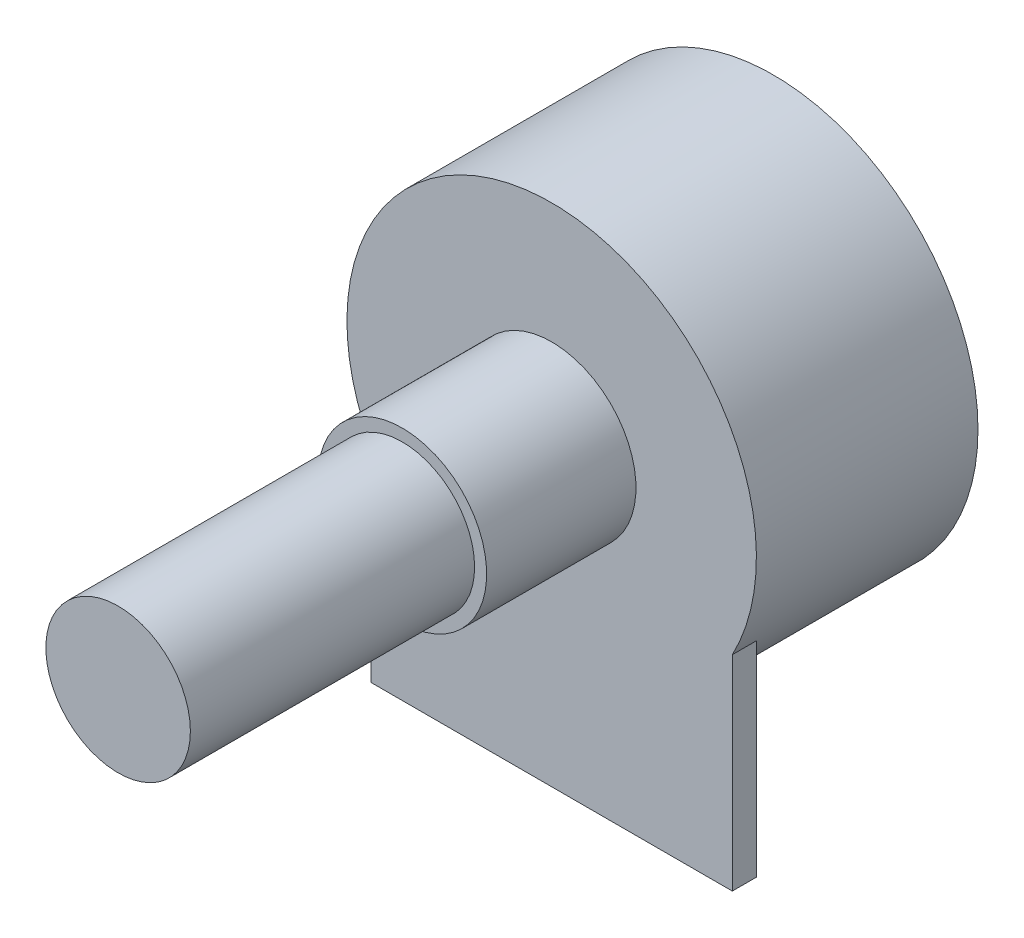
from build123d import *

# Parameters (mm, degrees)
SCHIZZO1_R                   = 8.5
ESTRUSIONE_ESTRUSIONE1_DEPTH = 9.2
SCHIZZO2_W                   = 15
SCHIZZO2_H                   = 8.5
ESTRUSIONE_ESTRUSIONE2_DEPTH = 1
SCHIZZO3_R                   = 3.5
ESTRUSIONE_ESTRUSIONE3_DEPTH = 6.2
SCHIZZO4_R                   = 3
ESTRUSIONE_ESTRUSIONE4_DEPTH = 11.8


with BuildPart() as part:
    # Schizzo1 → Estrusione-Estrusione1 (new body)
    with BuildSketch(Plane.XY):
        Circle(SCHIZZO1_R)
    extrude(amount=ESTRUSIONE_ESTRUSIONE1_DEPTH)

    # Schizzo2 → Estrusione-Estrusione2 (add)
    with BuildSketch(Plane.XY.offset(9.2)):
        with Locations((0, -8.25)):
            Rectangle(SCHIZZO2_W, SCHIZZO2_H)
    extrude(amount=-ESTRUSIONE_ESTRUSIONE2_DEPTH)

    # Schizzo3 → Estrusione-Estrusione3 (add)
    with BuildSketch(Plane.XY.offset(9.2)):
        with Locations(Location((0, 0, 0), (0, 0, 180))):
            Circle(SCHIZZO3_R)
    extrude(amount=ESTRUSIONE_ESTRUSIONE3_DEPTH)

    # Schizzo4 → Estrusione-Estrusione4 (add)
    with BuildSketch(Plane.XY.offset(15.4)):
        Circle(SCHIZZO4_R)
    extrude(amount=ESTRUSIONE_ESTRUSIONE4_DEPTH)


solid = part.part
